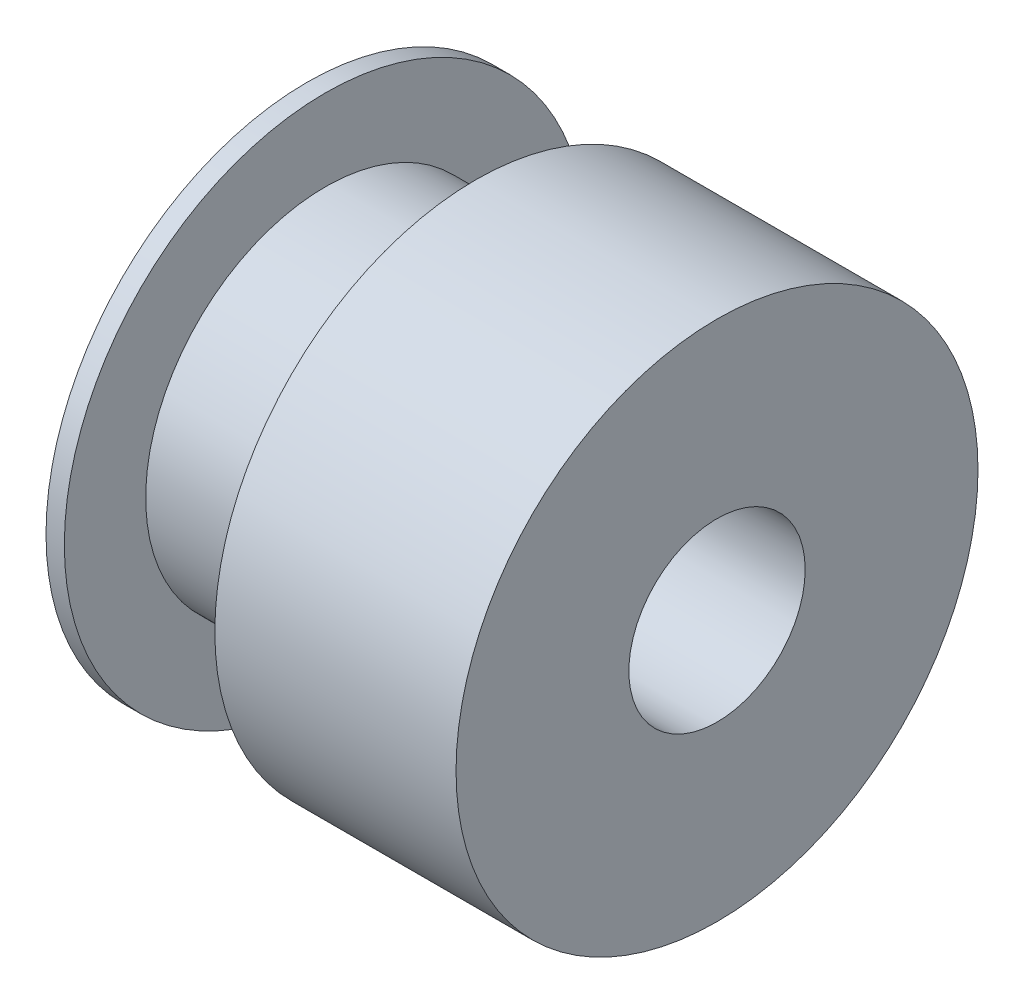
from build123d import *

# Parameters (mm, degrees)
SKETCH1_R           = 7.0485
BOSS_EXTRUDE1_DEPTH = 0.4953
SKETCH2_R           = 4.8514
BOSS_EXTRUDE2_DEPTH = 4.064
SKETCH3_R           = 7.0485
BOSS_EXTRUDE3_DEPTH = 0.4953
SKETCH4_R           = 7.0485
BOSS_EXTRUDE4_DEPTH = 6.0198
SKETCH5_R           = 2.38125
CUT_EXTRUDE1_DEPTH  = 15.899833551


with BuildPart() as part:
    # Sketch1 → Boss-Extrude1 (new body)
    with BuildSketch(Plane(origin=(0, 0, 0), x_dir=(0, 0, -1), z_dir=(1, 0, 0))):
        Circle(SKETCH1_R)
    extrude(amount=BOSS_EXTRUDE1_DEPTH)

    # Sketch2 → Boss-Extrude2 (add)
    with BuildSketch(Plane(origin=(0.4953, 0, 0), x_dir=(0, 0, -1), z_dir=(1, 0, 0))):
        Circle(SKETCH2_R)
    extrude(amount=BOSS_EXTRUDE2_DEPTH)

    # Sketch3 → Boss-Extrude3 (add)
    with BuildSketch(Plane(origin=(4.5593, 0, 0), x_dir=(0, 0, -1), z_dir=(1, 0, 0))):
        Circle(SKETCH3_R)
    extrude(amount=BOSS_EXTRUDE3_DEPTH)

    # Sketch4 → Boss-Extrude4 (add)
    with BuildSketch(Plane(origin=(5.0546, 0, 0), x_dir=(0, 0, -1), z_dir=(1, 0, 0))):
        Circle(SKETCH4_R)
    extrude(amount=BOSS_EXTRUDE4_DEPTH)

    # Sketch5 → Cut-Extrude1 (cut, through all)
    with BuildSketch(Plane(origin=(11.0744, 0, 0), x_dir=(0, 0, -1), z_dir=(1, 0, 0))):
        Circle(SKETCH5_R)
    extrude(amount=-CUT_EXTRUDE1_DEPTH, mode=Mode.SUBTRACT)


solid = part.part
